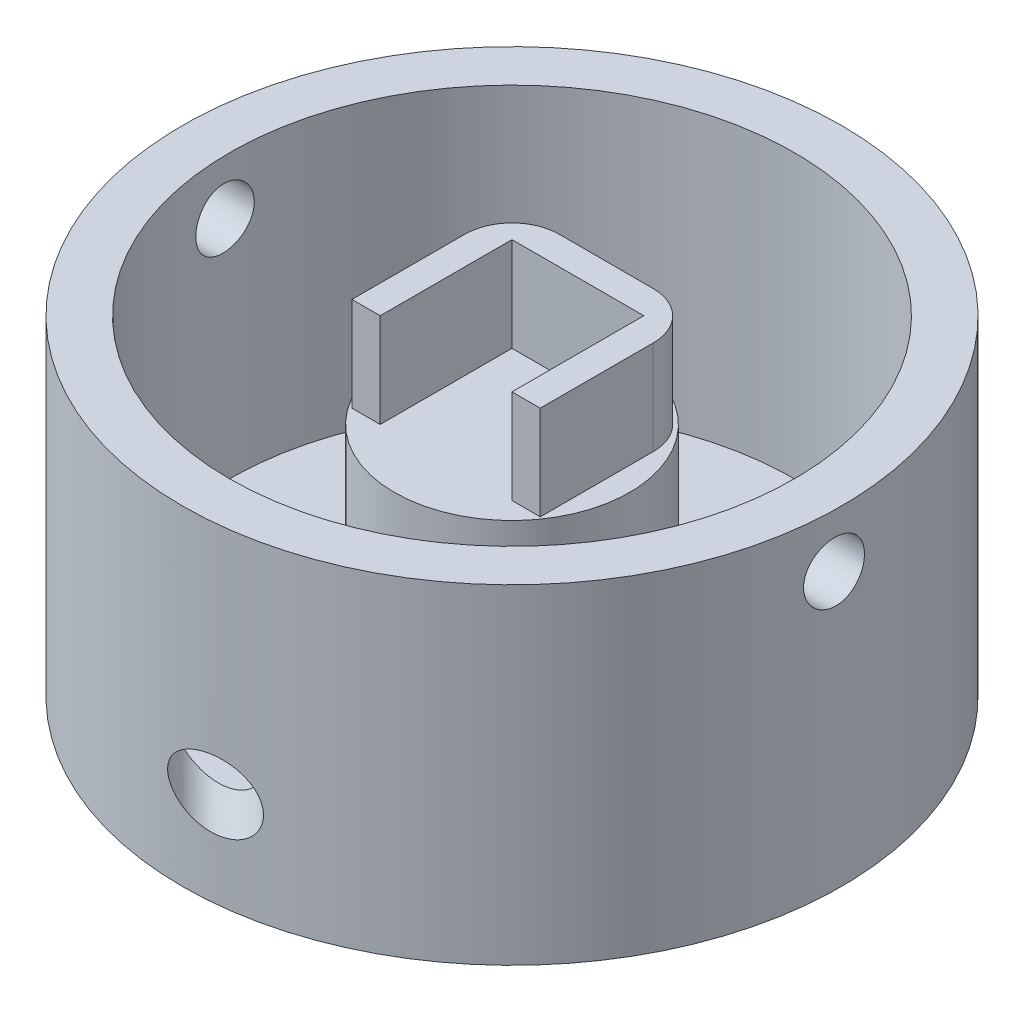
from build123d import *

# Parameters (mm, degrees)
SKETCH1_R           = 35
BOSS_EXTRUDE1_DEPTH = 35
SKETCH3_R           = 30
CUT_EXTRUDE1_DEPTH  = 30
SKETCH4_R           = 12.5
BOSS_EXTRUDE2_DEPTH = 20
SKETCH5_R           = 3.6
CUT_EXTRUDE2_DEPTH  = 20
BOSS_EXTRUDE3_DEPTH = 10
SKETCH8_R           = 3.175
CUT_EXTRUDE4_DEPTH  = 67.895440973
SKETCH10_R          = 3.175
CUT_EXTRUDE5_DEPTH  = 67.895440995


with BuildPart() as part:
    # Sketch1 → Boss-Extrude1 (new body)
    with BuildSketch(Plane(origin=(0, 0, 0), x_dir=(1, 0, 0), z_dir=(0, 1, 0))):
        with Locations(Location((0, 0, 0), (0, 0, 270))):
            Circle(SKETCH1_R)
    extrude(amount=BOSS_EXTRUDE1_DEPTH)

    # Sketch3 → Cut-Extrude1 (cut)
    with BuildSketch(Plane(origin=(0, 35, 0), x_dir=(1, 0, 0), z_dir=(0, 1, 0))):
        with Locations(Location((0, 0, 0), (0, 0, 270))):
            Circle(SKETCH3_R)
    extrude(amount=-CUT_EXTRUDE1_DEPTH, mode=Mode.SUBTRACT)

    # Sketch4 → Boss-Extrude2 (add)
    with BuildSketch(Plane(origin=(0, 5, 0), x_dir=(1, 0, 0), z_dir=(0, 1, 0))):
        with Locations(Location((0, 0, 0), (0, 0, 270))):
            Circle(SKETCH4_R)
    extrude(amount=BOSS_EXTRUDE2_DEPTH)

    # Sketch5 → Cut-Extrude2 (cut)
    with BuildSketch(Plane(origin=(24.748737342, 0, 24.748737342), x_dir=(0, -1, 0), z_dir=(0.7071067811865488, 0, 0.7071067811865464))):
        with Locations(Location((-10, -22.260066462, 0), (0, 0, 90))):
            Circle(SKETCH5_R)
    extrude(amount=-CUT_EXTRUDE2_DEPTH, mode=Mode.SUBTRACT)

    # Sketch6 → Boss-Extrude3 (add)
    with BuildSketch(Plane(origin=(0, 25, 0), x_dir=(1, 0, 0), z_dir=(0, 1, 0))):
        with BuildLine():
            Line((-10, -7), (-10, 5))
            ThreePointArc((-10, 5), (-8.535533906, 8.535533906), (-5, 10))
            Line((-5, 10), (5, 10))
            ThreePointArc((5, 10), (8.535533906, 8.535533906), (10, 5))
            Line((10, 5), (10, -7))
            Line((10, -7), (7, -7))
            Line((7, -7), (7, 7))
            Line((7, 7), (-7, 7))
            Line((-7, 7), (-7, -7))
            Line((-7, -7), (-10, -7))
        make_face()
    extrude(amount=BOSS_EXTRUDE3_DEPTH)

    # Sketch8 → Cut-Extrude4 (cut, through all)
    with BuildSketch(Plane(origin=(10, 0, 0), x_dir=(0, 0, -1), z_dir=(1, 0, 0))):
        with Locations(Location((-0.65, 29.285, 0), (0, 0, 180))):
            Circle(SKETCH8_R)
    extrude(amount=CUT_EXTRUDE4_DEPTH, mode=Mode.SUBTRACT)

    # Sketch10 → Cut-Extrude5 (cut, through all)
    with BuildSketch(Plane.ZY.offset(10)):
        with Locations((0.65, 29.285)):
            Circle(SKETCH10_R)
    extrude(amount=CUT_EXTRUDE5_DEPTH, mode=Mode.SUBTRACT)


solid = part.part
